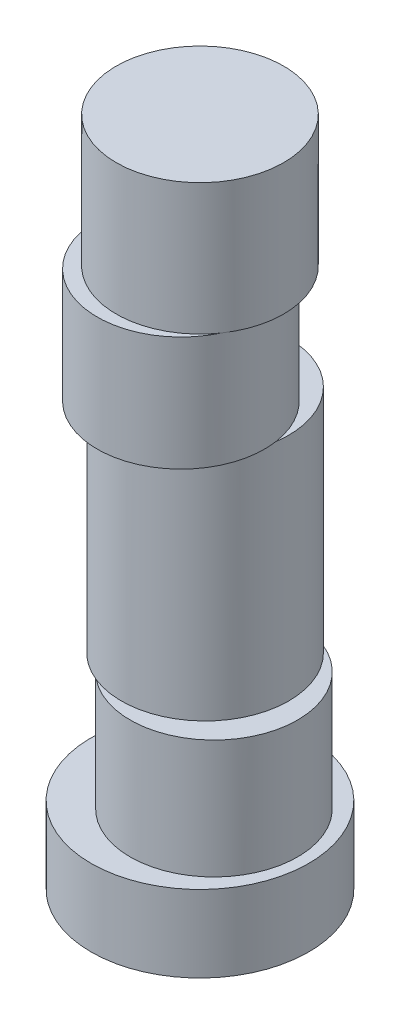
from build123d import *

# Parameters (mm, degrees)
SKETCH1_R           = 7.8
BOSS_EXTRUDE1_DEPTH = 5.5
SKETCH2_R           = 6
BOSS_EXTRUDE2_DEPTH = 8.5
SKETCH4_R           = 6
BOSS_EXTRUDE3_DEPTH = 16.5
SKETCH7_R           = 6
BOSS_EXTRUDE4_DEPTH = 8.2
SKETCH3_R           = 4
CUT_EXTRUDE2_DEPTH  = 41.241396596
SKETCH8_R           = 6
BOSS_EXTRUDE5_DEPTH = 9.4


with BuildPart() as part:
    # Sketch1 → Boss-Extrude1 (new body)
    with BuildSketch(Plane(origin=(0, 0, 0), x_dir=(1, 0, 0), z_dir=(0, 1, 0))):
        with Locations(Location((0, 0, 0), (0, 0, 270))):
            Circle(SKETCH1_R)
    extrude(amount=BOSS_EXTRUDE1_DEPTH)

    # Sketch2 → Boss-Extrude2 (add)
    with BuildSketch(Plane(origin=(0, 5.5, 0), x_dir=(1, 0, 0), z_dir=(0, 1, 0))):
        with Locations(Location((1, 0, 0), (0, 0, 270))):
            Circle(SKETCH2_R)
    extrude(amount=BOSS_EXTRUDE2_DEPTH)

    # Sketch4 → Boss-Extrude3 (add)
    with BuildSketch(Plane(origin=(0, 14, 0), x_dir=(1, 0, 0), z_dir=(0, 1, 0))):
        with Locations(Location((-0.5, 0.866025404, 0), (0, 0, 51.701078932))):
            Circle(SKETCH4_R)
    extrude(amount=BOSS_EXTRUDE3_DEPTH)

    # Sketch7 → Boss-Extrude4 (add)
    with BuildSketch(Plane(origin=(0, 30.5, 0), x_dir=(1, 0, 0), z_dir=(0, 1, 0))):
        with Locations(Location((-0.5, -0.866025404, 0), (0, 0, 8.298921068))):
            Circle(SKETCH7_R)
    extrude(amount=BOSS_EXTRUDE4_DEPTH)

    # Sketch3 → Cut-Extrude2 (cut, through all)
    with BuildSketch(Plane.XZ):
        with Locations(Location((0, 0, 0), (0, 0, 270))):
            Circle(SKETCH3_R)
    extrude(amount=-CUT_EXTRUDE2_DEPTH, mode=Mode.SUBTRACT)

    # Sketch8 → Boss-Extrude5 (add)
    with BuildSketch(Plane(origin=(0, 38.7, 0), x_dir=(1, 0, 0), z_dir=(0, 1, 0))):
        with Locations(Location((0, 0, 0), (0, 0, 154.780191847))):
            Circle(SKETCH8_R)
    extrude(amount=BOSS_EXTRUDE5_DEPTH)


solid = part.part
